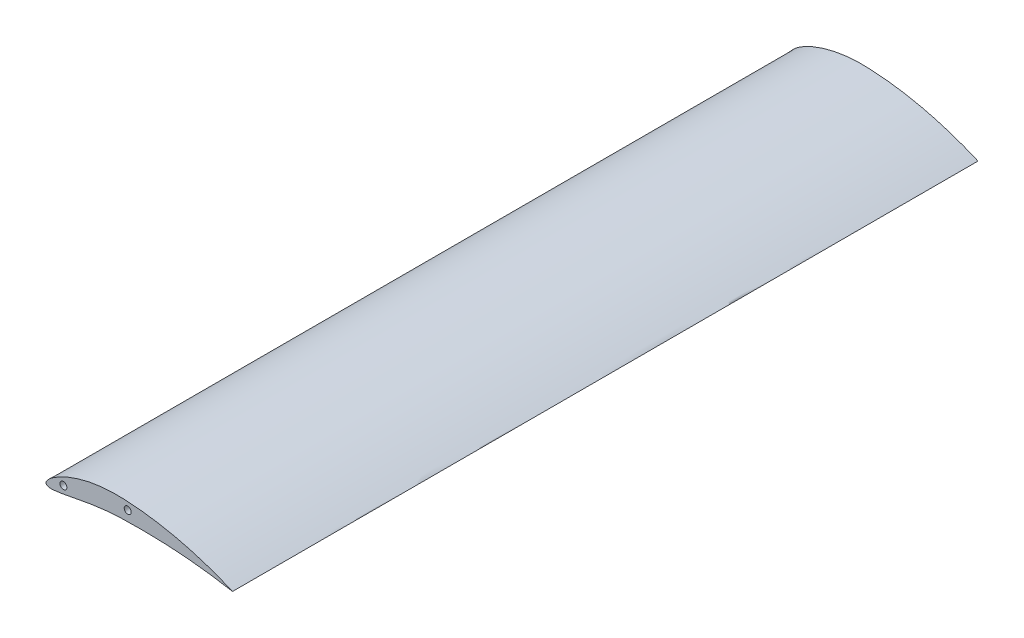
from build123d import *

# Parameters (mm, degrees)
BOSS_EXTRUDE1_DEPTH = 508
CUT_EXTRUDE1_REACH  = 1049.861
SKETCH3_R           = 4.7625
SKETCH4_R           = 4.7625
BOSS_EXTRUDE2_DEPTH = 127
CUT_EXTRUDE3_DEPTH  = 120.65


with BuildPart() as part:
    # Sketch1 → Boss-Extrude1 (new, symmetric)
    with BuildSketch(Plane.XY):
        with BuildLine():
            add(Edge.make_bspline(
                [(254, 0), (254.002893482, 0.009706091), (253.477527879, 0.209398181), (252.949506037, 0.461141777), (251.634261386, 1.008295367), (250.002681167, 1.703474954), (247.831787554, 2.606145622), (245.221969161, 3.677217108), (242.146577503, 4.913515019), (238.627740243, 6.296809437), (234.67228441, 7.81008524), (230.294926317, 9.435811029), (225.509669554, 11.153939959), (220.332866987, 12.94438959), (214.782178744, 14.785221379), (208.877356178, 16.65618159), (202.63919469, 18.535104999), (196.090231851, 20.400989036), (189.25442583, 22.232631868), (182.157334842, 24.009920587), (174.825652649, 25.712766788), (167.287572563, 27.323334674), (159.572252199, 28.823709102), (151.710156906, 30.198155188), (143.73278447, 31.432160728), (135.67248117, 32.512868659), (127.562306475, 33.428639158), (119.436205678, 34.172176027), (111.328291738, 34.732634241), (103.211393299, 35.121054115), (95.099465686, 35.282416862), (87.029553447, 35.075579648), (79.106501551, 34.543461365), (71.386421736, 33.693897181), (63.908646209, 32.551558852), (56.710699674, 31.141291538), (49.827978354, 29.494126849), (43.293614171, 27.642394469), (37.138164618, 25.621605092), (31.388510807, 23.470671552), (26.069821688, 21.226159376), (21.20283506, 18.92801018), (16.805808626, 16.613938979), (12.894163005, 14.32009326), (9.479048158, 12.082665219), (6.569910916, 9.932614642), (4.172163168, 7.898734142), (2.287747942, 6.005070871), (0.913441801, 4.26813225), (0.044369976, 2.692951604), (-0.318412015, 1.254733177), (-0.094165747, -0.042447145), (0.725695004, -1.068606647), (2.025784695, -1.759696942), (3.747761044, -2.186421988), (5.905164056, -2.381889133), (8.496332616, -2.362035977), (11.513215651, -2.14032165), (14.942088582, -1.732738153), (18.766666522, -1.158037352), (22.968977807, -0.436876546), (27.530120842, 0.407082111), (32.430511922, 1.349683716), (37.650383472, 2.364930683), (43.169691456, 3.42664098), (48.968953673, 4.506957646), (55.02849364, 5.579133509), (61.329146927, 6.615660032), (67.852096387, 7.589819061), (74.57874205, 8.475179759), (81.490508777, 9.24870041), (88.568945781, 9.883281565), (95.810846202, 10.368423088), (103.258823401, 10.651090051), (110.883417203, 10.847322909), (118.642645092, 10.992067429), (126.44645874, 11.062721398), (134.265990295, 11.057432203), (142.072363373, 10.971394283), (149.836007192, 10.802948848), (157.52716175, 10.5514915), (165.115929504, 10.219624653), (172.572157263, 9.811186605), (179.866078747, 9.331243183), (186.967885476, 8.787320659), (193.848579242, 8.18855716), (200.479196187, 7.54385543), (206.83196264, 6.86482345), (212.879568444, 6.162615287), (218.596013471, 5.44968657), (223.956148698, 4.737592485), (228.936481189, 4.039090774), (233.514516905, 3.365956593), (237.669985048, 2.729700523), (241.382411049, 2.140580688), (244.63894449, 1.608548299), (247.412171556, 1.144869284), (249.723847999, 0.747527633), (251.469697036, 0.450424645), (252.869088586, 0.190978387), (253.448519931, 0.112422849), (253.997105444, -0.009709695), (254, 0)],
                knots=[0, 0, 0, 0, 0.000500326, 0.001999908, 0.004491016, 0.007962981, 0.012400212, 0.017782637, 0.024086033, 0.031283105, 0.039342427, 0.048228584, 0.05790426, 0.068327959, 0.07945652, 0.091243042, 0.103640126, 0.116597604, 0.130063469, 0.14398459, 0.158306115, 0.172972351, 0.18792732, 0.203113116, 0.2184717, 0.233944808, 0.249473445, 0.264998855, 0.280462153, 0.295803845, 0.311323629, 0.326706508, 0.341810405, 0.356582637, 0.370971506, 0.384923777, 0.398386753, 0.411306988, 0.423632654, 0.435311865, 0.446295011, 0.456534872, 0.465987533, 0.47461304, 0.482377355, 0.489253053, 0.495223641, 0.50028594, 0.504461055, 0.507811561, 0.510480594, 0.512762222, 0.515043424, 0.517702037, 0.521013381, 0.525103948, 0.530021122, 0.535771893, 0.542341397, 0.549702684, 0.557818571, 0.566648243, 0.576147104, 0.58626814, 0.596964793, 0.60818991, 0.61989864, 0.632046653, 0.644592154, 0.657497245, 0.670724393, 0.684239663, 0.698010813, 0.712098303, 0.726728066, 0.74149363, 0.756341333, 0.771219325, 0.786072643, 0.800847937, 0.815489998, 0.829943038, 0.844152554, 0.858061386, 0.871615338, 0.88475832, 0.897436299, 0.90959464, 0.921181699, 0.932145359, 0.942436617, 0.952008463, 0.960816148, 0.968817229, 0.975973665, 0.982250118, 0.987615556, 0.992043304, 0.995510912, 0.998000498, 0.999499488, 1, 1, 1, 1], degree=3))
        make_face()
    extrude(amount=BOSS_EXTRUDE1_DEPTH, both=True)

    # Sketch3 → Cut-Extrude1 (cut, up to next)
    with BuildSketch(Plane(origin=(0, 0, -508), x_dir=(-1, 0, 0), z_dir=(0, 0, -1)), mode=Mode.PRIVATE) as cut_extrude1_sk1:
        with Locations((-23.45232519, 9.819528409)):
            Circle(SKETCH3_R)
    cut_extrude1_tool1 = extrude(cut_extrude1_sk1.sketch, amount=-CUT_EXTRUDE1_REACH, mode=Mode.PRIVATE) & part.part
    # Sketch3 → Cut-Extrude1 (cut, up to next)
    with BuildSketch(Plane(origin=(0, 0, -508), x_dir=(-1, 0, 0), z_dir=(0, 0, -1)), mode=Mode.PRIVATE) as cut_extrude1_sk2:
        with Locations((-111.122435962, 24.555934929)):
            Circle(SKETCH3_R)
    cut_extrude1_tool2 = extrude(cut_extrude1_sk2.sketch, amount=-CUT_EXTRUDE1_REACH, mode=Mode.PRIVATE) & part.part
    add(cut_extrude1_tool1.solids().sort_by_distance((23.452325, 9.819528, -508))[0], mode=Mode.SUBTRACT)
    add(cut_extrude1_tool2.solids().sort_by_distance((111.122436, 24.555935, -508))[0], mode=Mode.SUBTRACT)

    # Sketch4 → Boss-Extrude2 (add, symmetric)
    with BuildSketch(Plane.XY):
        with BuildLine():
            Line((25.10940545, -0.038805089), (25.951485823, -5.048525704))
            ThreePointArc((25.951485823, -5.048525704), (31.108370669, -13.287945175), (40.580988293, -15.467626312))
            Line((40.580988293, -15.467626312), (103.202495988, -4.941621654))
            ThreePointArc((103.202495988, -4.941621654), (111.441915459, 0.215263191), (113.621596596, 9.687880816))
            Line((113.621596596, 9.687880816), (113.419296514, 10.89140832))
            add(Edge.make_bspline(
                [(25.10940545, -0.038805089), (25.877834055, 0.102672578), (28.283739447, 0.5520424), (32.430511922, 1.349683716), (37.650383472, 2.364930683), (43.169691456, 3.42664098), (48.968953673, 4.506957646), (55.02849364, 5.579133509), (61.329146927, 6.615660032), (67.852096387, 7.589819061), (74.57874205, 8.475179759), (81.490508777, 9.24870041), (88.568945781, 9.883281565), (95.810846202, 10.368423088), (103.258823401, 10.651090051), (109.147376484, 10.802642728), (112.566115929, 10.874571687), (113.419296514, 10.89140832)],
                knots=[0.562193758, 0.562193758, 0.562193758, 0.562193758, 0.566648243, 0.576147104, 0.58626814, 0.596964793, 0.60818991, 0.61989864, 0.632046653, 0.644592154, 0.657497245, 0.670724393, 0.684239663, 0.698010813, 0.712098303, 0.726728066, 0.731593045, 0.731593045, 0.731593045, 0.731593045], degree=3))
        make_face()
        with Locations((39.107347641, -6.700615234)):
            Circle(SKETCH4_R, mode=Mode.SUBTRACT)
        with Locations((89.204553797, 1.720188492)):
            Circle(SKETCH4_R, mode=Mode.SUBTRACT)
    extrude(amount=BOSS_EXTRUDE2_DEPTH, both=True)

    # Sketch6 → Cut-Extrude3 (cut, symmetric)
    with BuildSketch(Plane.XY):
        with BuildLine():
            Line((25.10940545, -0.038805089), (25.951485823, -5.048525704))
            ThreePointArc((25.951485823, -5.048525704), (31.108370669, -13.287945175), (40.580988293, -15.467626312))
            Line((40.580988293, -15.467626312), (103.202495988, -4.941621654))
            ThreePointArc((103.202495988, -4.941621654), (111.441915459, 0.215263191), (113.621596596, 9.687880816))
            Line((113.621596596, 9.687880816), (113.419296514, 10.89140832))
            add(Edge.make_bspline(
                [(113.419296514, 10.89140832), (112.566115929, 10.874571687), (109.147376484, 10.802642728), (103.258823401, 10.651090051), (95.810846202, 10.368423088), (88.568945781, 9.883281565), (81.490508777, 9.24870041), (74.57874205, 8.475179759), (67.852096387, 7.589819061), (61.329146927, 6.615660032), (55.02849364, 5.579133509), (48.968953673, 4.506957646), (43.169691456, 3.42664098), (37.650383472, 2.364930683), (32.430511922, 1.349683716), (28.283739447, 0.5520424), (25.877834055, 0.102672578), (25.10940545, -0.038805089)],
                knots=[0.268406955, 0.268406955, 0.268406955, 0.268406955, 0.273271934, 0.287901697, 0.301989187, 0.315760337, 0.329275607, 0.342502755, 0.355407846, 0.367953347, 0.38010136, 0.39181009, 0.403035207, 0.41373186, 0.423852896, 0.433351757, 0.437806242, 0.437806242, 0.437806242, 0.437806242], degree=3))
        make_face()
    extrude(amount=CUT_EXTRUDE3_DEPTH, both=True, mode=Mode.SUBTRACT)


solid = part.part
